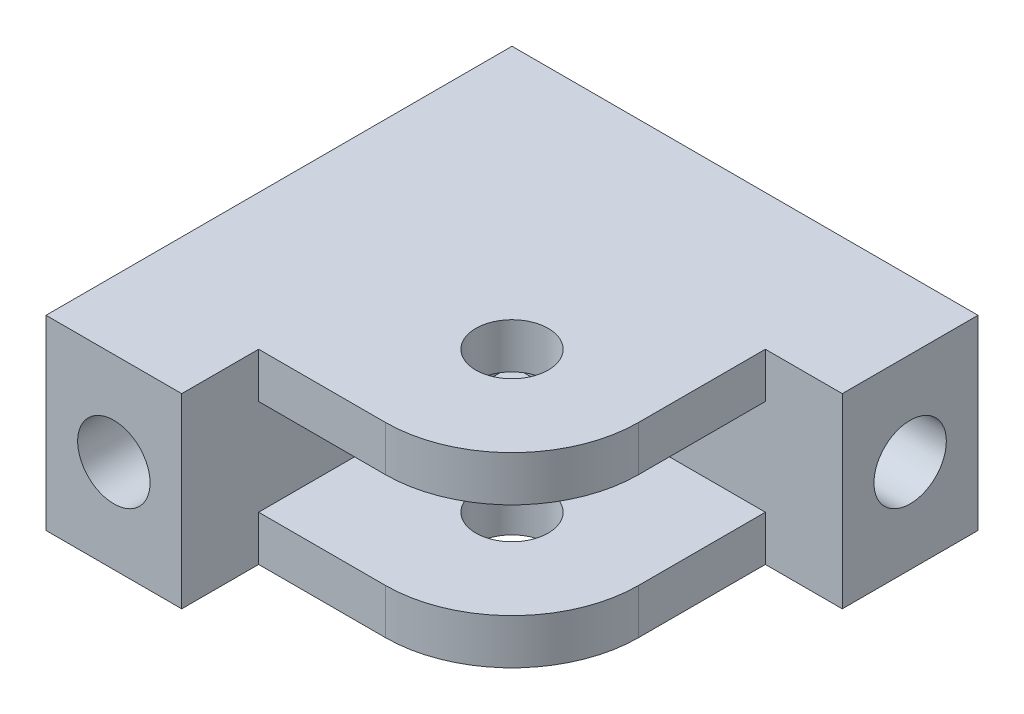
from build123d import *

# Parameters (mm, degrees)
SKETCH1_W           = 8
SKETCH1_H           = 40
SKETCH1_W_2         = 40
SKETCH1_H_2         = 8
BOSS_EXTRUDE1_DEPTH = 20.6
SKETCH1_3_R         = 4
BOSS_EXTRUDE2_DEPTH = 5
BOSS_EXTRUDE4_START = 15.6
SKETCH1_4_R         = 4
BOSS_EXTRUDE4_DEPTH = 5
SKETCH2_R           = 4
CUT_EXTRUDE1_DEPTH  = 40
CHAMFER1_SIZE       = 1
SKETCH5_R           = 4
CUT_EXTRUDE7_DEPTH  = 40
CHAMFER2_SIZE       = 1


with BuildPart() as part:
    # Sketch1 → Boss-Extrude1 (new body)
    with BuildSketch(Plane(origin=(0, 0, 0), x_dir=(1, 0, 0), z_dir=(0, 1, 0))):
        Polygon((-49.993785762, 7.13734227), (-49.993785762, 47.13734227), (-41.993785762, 47.13734227), (-41.993785762, 55.13734227), (-1.993785762, 55.13734227), (-1.993785762, 58.63734227), (-53.493785762, 58.63734227), (-53.493785762, 7.13734227), align=None)
        with Locations((-45.993785762, 27.13734227)):
            Rectangle(SKETCH1_W, SKETCH1_H)
        Polygon((-1.993785762, 47.13734227), (-41.993785762, 47.13734227), (-41.993785762, 7.13734227), (-38.493785762, 7.13734227), (-38.493785762, 15.63734227), (-38.493785762, 43.63734227), (-10.493785762, 43.63734227), (-1.993785762, 43.63734227), align=None)
        with Locations((-21.993785762, 51.13734227)):
            Rectangle(SKETCH1_W_2, SKETCH1_H_2)
    extrude(amount=BOSS_EXTRUDE1_DEPTH)

    # Sketch1<3> → Boss-Extrude2 (add)
    with BuildSketch(Plane(origin=(0, 0, 0), x_dir=(1, 0, 0), z_dir=(0, 1, 0))):
        with BuildLine():
            Line((-38.493785762, 43.63734227), (-38.493785762, 15.63734227))
            Line((-38.493785762, 15.63734227), (-24.493785762, 15.63734227))
            ThreePointArc((-24.493785762, 15.63734227), (-14.594290825, 19.737847333), (-10.493785762, 29.63734227))
            Line((-10.493785762, 29.63734227), (-10.493785762, 43.63734227))
            Line((-10.493785762, 43.63734227), (-38.493785762, 43.63734227))
        make_face()
        with Locations(Location((-24.493785762, 29.63734227, 0), (0, 0, 270))):
            Circle(SKETCH1_3_R, mode=Mode.SUBTRACT)
    extrude(amount=BOSS_EXTRUDE2_DEPTH)

    # Sketch1<4> → Boss-Extrude4 (add)
    with BuildSketch(Plane(origin=(0, 0, 0), x_dir=(1, 0, 0), z_dir=(0, 1, 0)).offset(BOSS_EXTRUDE4_START)):
        with BuildLine():
            Line((-38.493785762, 43.63734227), (-38.493785762, 15.63734227))
            Line((-38.493785762, 15.63734227), (-24.493785762, 15.63734227))
            ThreePointArc((-24.493785762, 15.63734227), (-14.594290825, 19.737847333), (-10.493785762, 29.63734227))
            Line((-10.493785762, 29.63734227), (-10.493785762, 43.63734227))
            Line((-10.493785762, 43.63734227), (-38.493785762, 43.63734227))
        make_face()
        with Locations(Location((-24.493785762, 29.63734227, 0), (0, 0, 270))):
            Circle(SKETCH1_4_R, mode=Mode.SUBTRACT)
    extrude(amount=BOSS_EXTRUDE4_DEPTH)

    # Sketch2 → Cut-Extrude1 (cut)
    with BuildSketch(Plane.XY.offset(-7.13734227)):
        with Locations((-45.993785762, 10.3)):
            Circle(SKETCH2_R)
    extrude(amount=-CUT_EXTRUDE1_DEPTH, mode=Mode.SUBTRACT)

    # Chamfer1
    chamfer1_edges = [part.edges().sort_by_distance(p)[0] for p in [
        (-49.993785762, 10.3, -47.13734227),
    ]]
    chamfer(chamfer1_edges, length=CHAMFER1_SIZE)

    # Sketch5 → Cut-Extrude7 (cut)
    with BuildSketch(Plane(origin=(-1.993785762, 0, 0), x_dir=(0, 0, -1), z_dir=(1, 0, 0))):
        with Locations((51.13734227, 10.3)):
            Circle(SKETCH5_R)
    extrude(amount=-CUT_EXTRUDE7_DEPTH, mode=Mode.SUBTRACT)

    # Chamfer2
    chamfer2_edges = [part.edges().sort_by_distance(p)[0] for p in [
        (-41.993785762, 10.3, -47.13734227),
    ]]
    chamfer(chamfer2_edges, length=CHAMFER2_SIZE)


solid = part.part
